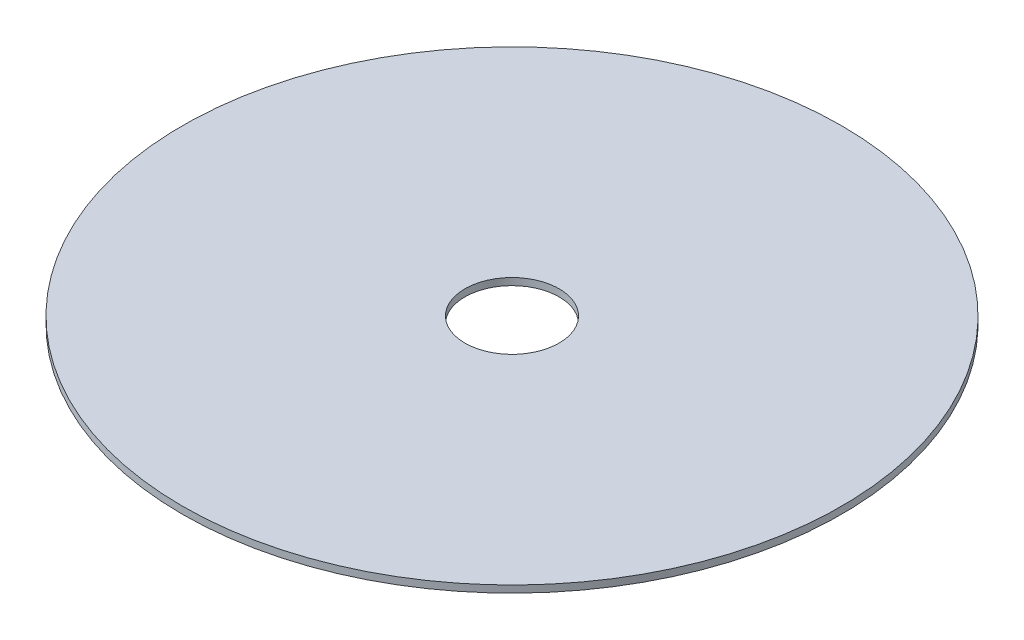
from build123d import *

# Parameters (mm, degrees)
SKETCH1_R           = 140
SKETCH1_R_2         = 20
BOSS_EXTRUDE1_DEPTH = 3


with BuildPart() as part:
    # Sketch1 → Boss-Extrude1 (new body)
    with BuildSketch(Plane(origin=(0, 0, 0), x_dir=(1, 0, 0), z_dir=(0, 1, 0))):
        with Locations(Location((0, 0, 0), (0, 0, 270))):
            Circle(SKETCH1_R)
        with Locations(Location((0, 0, 0), (0, 0, 270))):
            Circle(SKETCH1_R_2, mode=Mode.SUBTRACT)
    extrude(amount=BOSS_EXTRUDE1_DEPTH)


solid = part.part
